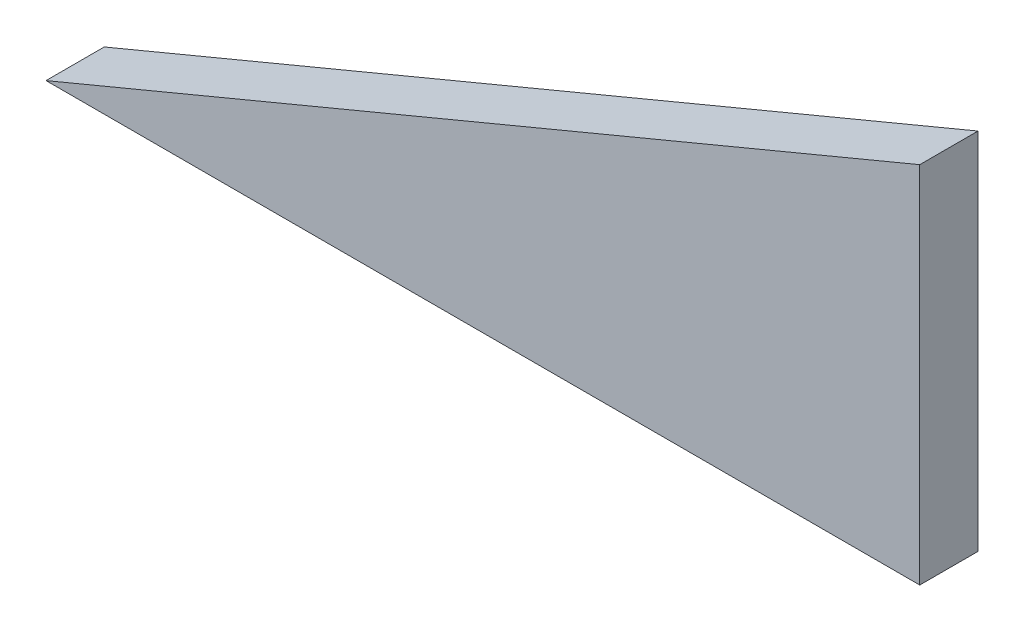
from build123d import *

# Parameters (mm, degrees)
AUFSATZ_LINEAR_AUSTRAGEN1_DEPTH = 4


with BuildPart() as part:
    # Skizze1 → Aufsatz-Linear austragen1 (new, symmetric)
    with BuildSketch(Plane.XY):
        Polygon((0, 0), (0, 50), (-120, 0), align=None)
    extrude(amount=AUFSATZ_LINEAR_AUSTRAGEN1_DEPTH, both=True)


solid = part.part
